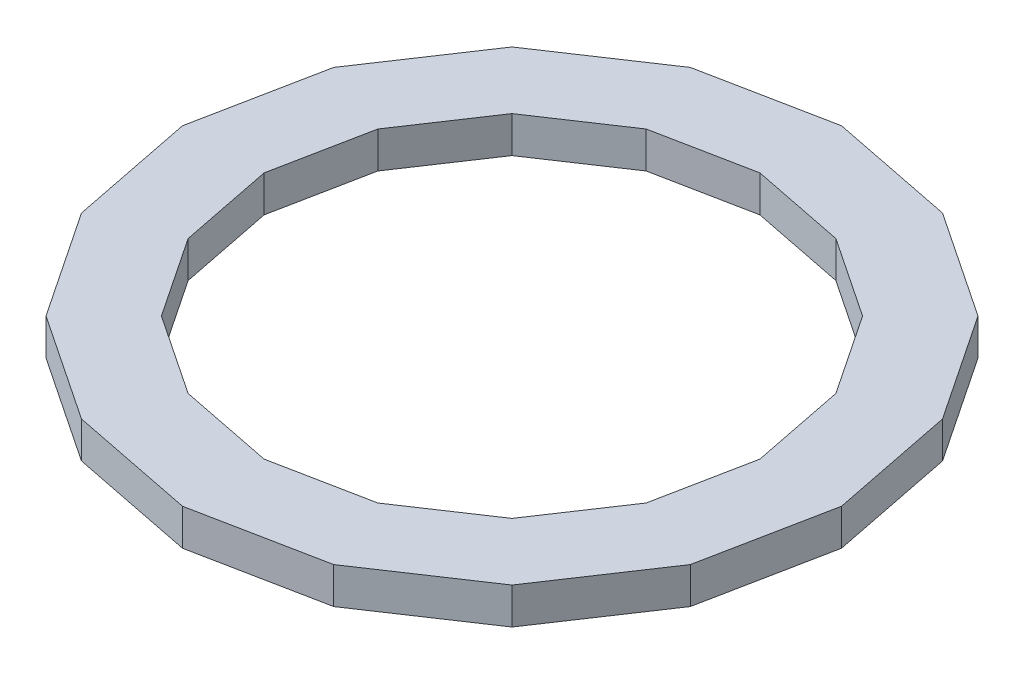
from build123d import *

# Parameters (mm, degrees)
BOSS_EXTRUDE1_DEPTH = 19.05


with BuildPart() as part:
    # Sketch1 → Boss-Extrude1 (new body)
    with BuildSketch(Plane(origin=(0, 0, 0), x_dir=(1, 0, 0), z_dir=(0, 1, 0))):
        Polygon((172.509838787, 0), (159.378309213, 66.016657224), (121.982876828, 121.982876828), (66.016657224, 159.378309213), (0, 172.509838787), (-66.016657224, 159.378309213), (-121.982876828, 121.982876828), (-159.378309213, 66.016657224), (-172.509838787, 0), (-159.378309213, -66.016657224), (-121.982876828, -121.982876828), (-66.016657224, -159.378309213), (0, -172.509838787), (66.016657224, -159.378309213), (121.982876828, -121.982876828), (159.378309213, -66.016657224), align=None)
        Polygon((129.778773347, 0), (119.89995245, 49.664186433), (91.767450688, 91.767450688), (49.664186433, 119.89995245), (0, 129.778773347), (-49.664186433, 119.89995245), (-91.767450688, 91.767450688), (-119.89995245, 49.664186433), (-129.778773347, 0), (-119.89995245, -49.664186433), (-91.767450688, -91.767450688), (-49.664186433, -119.89995245), (0, -129.778773347), (49.664186433, -119.89995245), (91.767450688, -91.767450688), (119.89995245, -49.664186433), align=None, mode=Mode.SUBTRACT)
    extrude(amount=BOSS_EXTRUDE1_DEPTH)


solid = part.part
